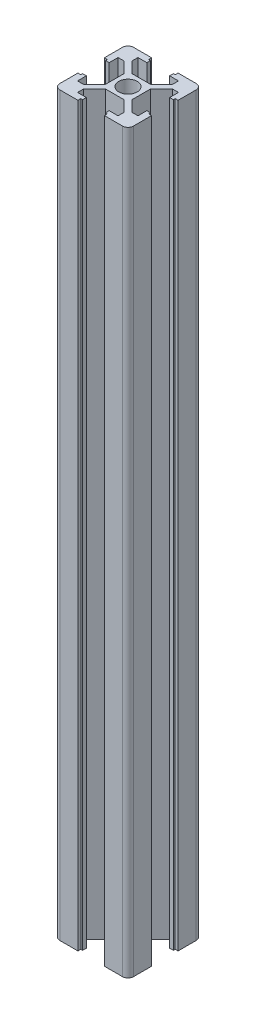
from build123d import *

# Parameters (mm, degrees)
SKETCH_1_R      = 2.5
EXTRUDE_1_DEPTH = 200


with BuildPart() as part:
    # 草图1 → 凸台-拉伸1 (new body)
    with BuildSketch(Plane(origin=(0, 0, 0), x_dir=(1, 0, 0), z_dir=(0, 1, 0))):
        with BuildLine():
            Line((-4.415608984, 3.873972711), (-4.415608984, -1.204706946))
            Line((-4.415608984, -1.204706946), (-7.376269156, -4.165367117))
            Line((-7.376269156, -4.165367117), (-9.015608984, -4.165367117))
            Line((-9.015608984, -4.165367117), (-9.015608984, -1.765367117))
            Line((-9.015608984, -1.765367117), (-10.015608984, -1.765367117))
            Line((-10.015608984, -1.765367117), (-10.015608984, -2.265367117))
            Line((-10.015608984, -2.265367117), (-10.815608984, -2.265367117))
            Line((-10.815608984, -2.265367117), (-10.815608984, -7.165367117))
            ThreePointArc((-10.815608984, -7.165367117), (-10.376269156, -8.226027289), (-9.315608984, -8.665367117))
            Line((-9.315608984, -8.665367117), (-4.415608984, -8.665367117))
            Line((-4.415608984, -8.665367117), (-4.415608984, -7.865367117))
            Line((-4.415608984, -7.865367117), (-3.915608984, -7.865367117))
            Line((-3.915608984, -7.865367117), (-3.915608984, -6.865367117))
            Line((-3.915608984, -6.865367117), (-6.315608984, -6.865367117))
            Line((-6.315608984, -6.865367117), (-6.315608984, -5.226027289))
            Line((-6.315608984, -5.226027289), (-3.354948812, -2.265367117))
            Line((-3.354948812, -2.265367117), (1.723730844, -2.265367117))
            Line((1.723730844, -2.265367117), (4.684391016, -5.226027289))
            Line((4.684391016, -5.226027289), (4.684391016, -6.865367117))
            Line((4.684391016, -6.865367117), (2.284391016, -6.865367117))
            Line((2.284391016, -6.865367117), (2.284391016, -7.865367117))
            Line((2.284391016, -7.865367117), (2.784391016, -7.865367117))
            Line((2.784391016, -7.865367117), (2.784391016, -8.665367117))
            Line((2.784391016, -8.665367117), (7.684391016, -8.665367117))
            ThreePointArc((7.684391016, -8.665367117), (8.745051188, -8.226027289), (9.184391016, -7.165367117))
            Line((9.184391016, -7.165367117), (9.184391016, -2.265367117))
            Line((9.184391016, -2.265367117), (8.384391016, -2.265367117))
            Line((8.384391016, -2.265367117), (8.384391016, -1.765367117))
            Line((8.384391016, -1.765367117), (7.384391016, -1.765367117))
            Line((7.384391016, -1.765367117), (7.384391016, -4.165367117))
            Line((7.384391016, -4.165367117), (5.745051188, -4.165367117))
            Line((5.745051188, -4.165367117), (2.784391016, -1.204706946))
            Line((2.784391016, -1.204706946), (2.784391016, 3.873972711))
            Line((2.784391016, 3.873972711), (5.745051188, 6.834632883))
            Line((5.745051188, 6.834632883), (7.384391016, 6.834632883))
            Line((7.384391016, 6.834632883), (7.384391016, 4.434632883))
            Line((7.384391016, 4.434632883), (8.384391016, 4.434632883))
            Line((8.384391016, 4.434632883), (8.384391016, 4.934632883))
            Line((8.384391016, 4.934632883), (9.184391016, 4.934632883))
            Line((9.184391016, 4.934632883), (9.184391016, 9.834632883))
            ThreePointArc((9.184391016, 9.834632883), (8.745051188, 10.895293054), (7.684391016, 11.334632883))
            Line((7.684391016, 11.334632883), (2.784391016, 11.334632883))
            Line((2.784391016, 11.334632883), (2.784391016, 10.534632883))
            Line((2.784391016, 10.534632883), (2.284391016, 10.534632883))
            Line((2.284391016, 10.534632883), (2.284391016, 9.534632883))
            Line((2.284391016, 9.534632883), (4.684391016, 9.534632883))
            Line((4.684391016, 9.534632883), (4.684391016, 7.895293054))
            Line((4.684391016, 7.895293054), (1.723730844, 4.934632883))
            Line((1.723730844, 4.934632883), (-3.354948812, 4.934632883))
            Line((-3.354948812, 4.934632883), (-6.315608984, 7.895293054))
            Line((-6.315608984, 7.895293054), (-6.315608984, 9.534632883))
            Line((-6.315608984, 9.534632883), (-3.915608984, 9.534632883))
            Line((-3.915608984, 9.534632883), (-3.915608984, 10.534632883))
            Line((-3.915608984, 10.534632883), (-4.415608984, 10.534632883))
            Line((-4.415608984, 10.534632883), (-4.415608984, 11.334632883))
            Line((-4.415608984, 11.334632883), (-9.315608984, 11.334632883))
            ThreePointArc((-9.315608984, 11.334632883), (-10.376269156, 10.895293054), (-10.815608984, 9.834632883))
            Line((-10.815608984, 9.834632883), (-10.815608984, 4.934632883))
            Line((-10.815608984, 4.934632883), (-10.015608984, 4.934632883))
            Line((-10.015608984, 4.934632883), (-10.015608984, 4.434632883))
            Line((-10.015608984, 4.434632883), (-9.015608984, 4.434632883))
            Line((-9.015608984, 4.434632883), (-9.015608984, 6.834632883))
            Line((-9.015608984, 6.834632883), (-7.376269156, 6.834632883))
            Line((-7.376269156, 6.834632883), (-4.415608984, 3.873972711))
        make_face()
        with Locations(Location((-0.815608984, 1.334632883, 0), (0, 0, 270))):
            Circle(SKETCH_1_R, mode=Mode.SUBTRACT)
    extrude(amount=EXTRUDE_1_DEPTH)


solid = part.part
